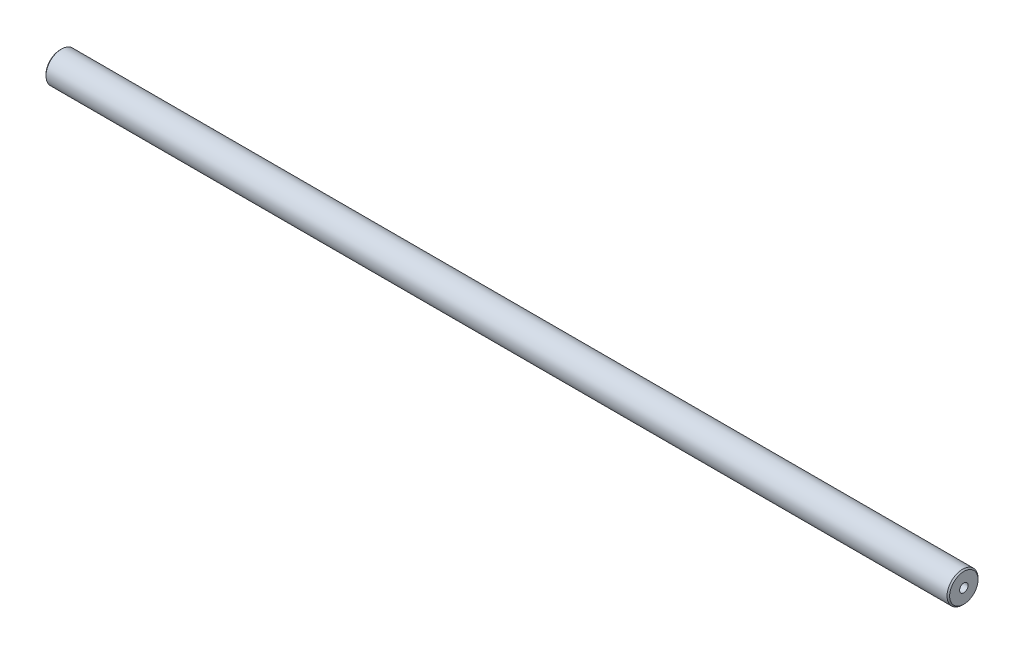
from build123d import *

# Parameters (mm, degrees)
SKETCH1_W          = 350
SKETCH1_H          = 6
TAPPED_HOLE1_D     = 3.3
TAPPED_HOLE1_DEPTH = 11.5
TAPPED_HOLE1_TIP   = 0.991420021
TAPPED_HOLE2_D     = 3.3
TAPPED_HOLE2_DEPTH = 11.5
TAPPED_HOLE2_TIP   = 0.991420021
CHAMFER1_SIZE      = 0.5


with BuildPart() as part:
    # Sketch1 → Revolve1 (revolve)
    with BuildSketch(Plane.XY):
        with Locations((175, 3)):
            Rectangle(SKETCH1_W, SKETCH1_H)
    revolve(axis=Axis((0, 0, 0), (1, 0, 0)))

    # Tapped Hole1
    with Locations(Plane.ZY):
        with Locations((0, 0)):
            Hole(TAPPED_HOLE1_D / 2, depth=TAPPED_HOLE1_DEPTH)
            with Locations((0, 0, -(TAPPED_HOLE1_DEPTH + TAPPED_HOLE1_TIP / 2))):  # 118° drill point
                Cone(0, TAPPED_HOLE1_D / 2, TAPPED_HOLE1_TIP, mode=Mode.SUBTRACT)

    # Tapped Hole2
    with Locations(Plane(origin=(350, 0, 0), x_dir=(0, 0, -1), z_dir=(1, 0, 0))):
        with Locations((0, 0)):
            Hole(TAPPED_HOLE2_D / 2, depth=TAPPED_HOLE2_DEPTH)
            with Locations((0, 0, -(TAPPED_HOLE2_DEPTH + TAPPED_HOLE2_TIP / 2))):  # 118° drill point
                Cone(0, TAPPED_HOLE2_D / 2, TAPPED_HOLE2_TIP, mode=Mode.SUBTRACT)

    # Chamfer1
    chamfer1_edges = [part.edges().sort_by_distance(p)[0] for p in [
        (0, -6, 0),
        (350, -6, 0),
    ]]
    chamfer(chamfer1_edges, length=CHAMFER1_SIZE)


solid = part.part
